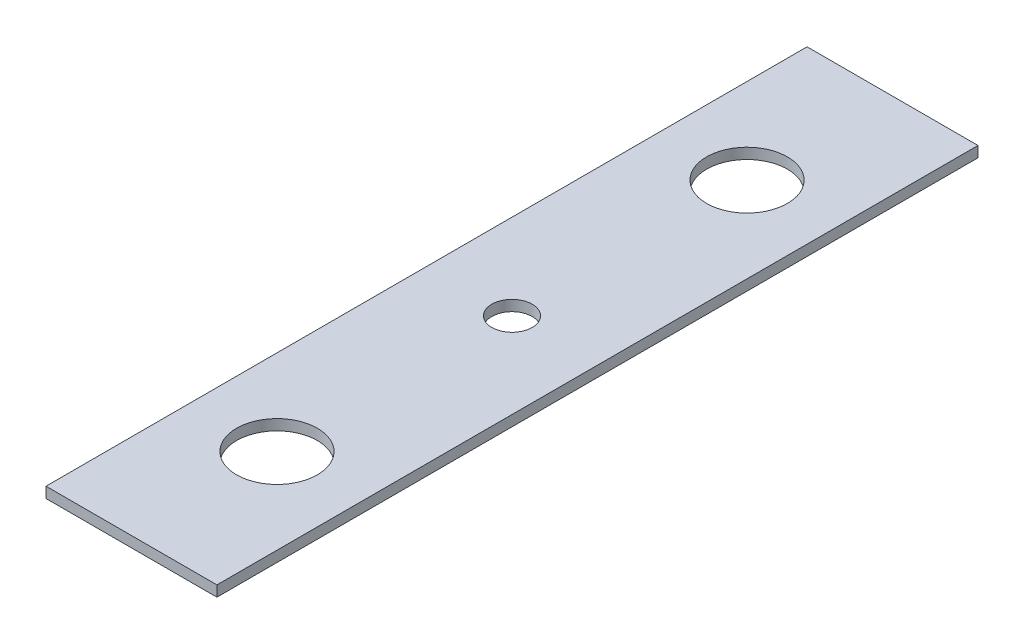
from build123d import *

# Parameters (mm, degrees)
SKETCH1_W           = 12.7
SKETCH1_H           = 56.55
SKETCH1_R           = 3
SKETCH1_R_2         = 1.5
BOSS_EXTRUDE1_DEPTH = 0.79375


with BuildPart() as part:
    # Sketch1 → Boss-Extrude1 (new body)
    with BuildSketch(Plane(origin=(0, 0, 0), x_dir=(1, 0, 0), z_dir=(0, 1, 0))):
        with Locations((202.847582207, 25.029038276)):
            Rectangle(SKETCH1_W, SKETCH1_H)
        with Locations(Location((202.847582207, 7.566538276, 0), (0, 0, 270))):
            Circle(SKETCH1_R, mode=Mode.SUBTRACT)
        with Locations(Location((202.847582207, 25.029038276, 0), (0, 0, 270))):
            Circle(SKETCH1_R_2, mode=Mode.SUBTRACT)
        with Locations(Location((202.847582207, 42.491538276, 0), (0, 0, 270))):
            Circle(SKETCH1_R, mode=Mode.SUBTRACT)
    extrude(amount=BOSS_EXTRUDE1_DEPTH)


solid = part.part
